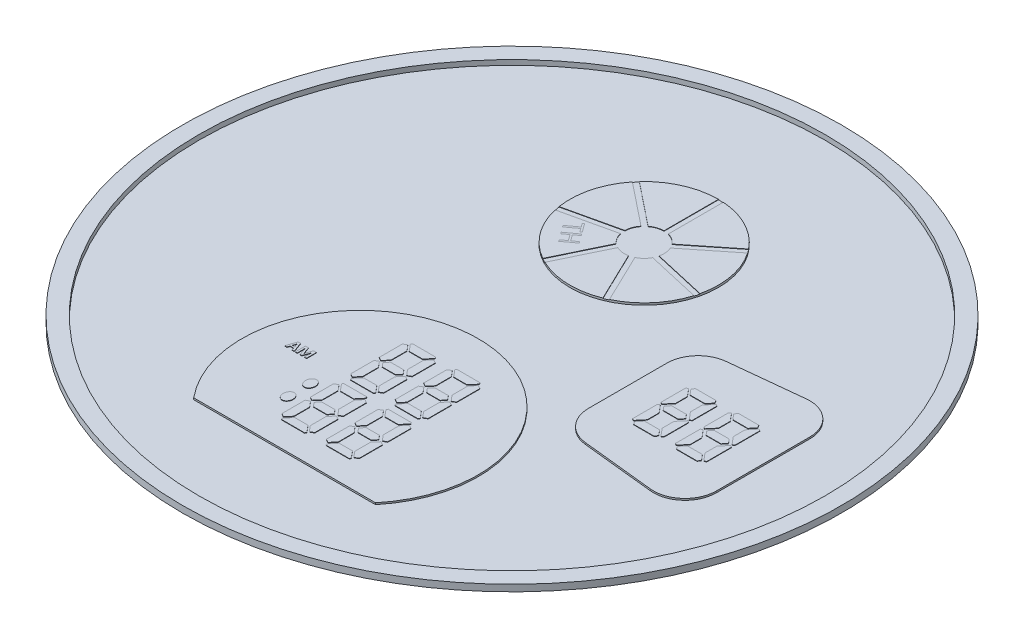
from build123d import *

# Parameters (mm, degrees)
SKETCH1_R           = 19.95
SKETCH1_R_2         = 3.942197232
BOSS_EXTRUDE1_DEPTH = 0.1
SKETCH2_R           = 4.5
BOSS_EXTRUDE2_DEPTH = 0.1
SKETCH2_5_RX        = 0.375
SKETCH2_5_RY        = 0.3
BOSS_EXTRUDE3_DEPTH = 0.125
SKETCH4_R           = 19.95
SKETCH4_R_2         = 18.95
BOSS_EXTRUDE4_DEPTH = 0.3


with BuildPart() as part:
    # Sketch1 → Boss-Extrude1 (new body)
    # profile 1 of 4: a face of its own
    with BuildSketch(Plane(origin=(0, 0, 0), x_dir=(1, 0, 0), z_dir=(0, 1, 0))):
        with Locations(Location((0, 0, 0), (0, 0, 270))):
            Circle(SKETCH1_R)
        with Locations((0, 8)):
            Circle(SKETCH1_R_2, mode=Mode.SUBTRACT)
        with BuildLine():
            ThreePointArc((8.4, -2.367660641), (8.528427587, -2.702225944), (8.847735768, -2.864921589))
            Line((8.847735768, -2.864921589), (13.247735768, -3.327380224))
            ThreePointArc((13.247735768, -3.327380224), (13.634565303, -3.201691689), (13.8, -2.830119276))
            Line((13.8, -2.830119276), (13.8, 2.830119276))
            ThreePointArc((13.8, 2.830119276), (13.634565303, 3.201691689), (13.247735768, 3.327380224))
            Line((13.247735768, 3.327380224), (8.847735768, 2.864921589))
            ThreePointArc((8.847735768, 2.864921589), (8.528427587, 2.702225944), (8.4, 2.367660641))
            Line((8.4, 2.367660641), (8.4, -2.367660641))
        make_face(mode=Mode.SUBTRACT)
        with BuildLine():
            ThreePointArc((4.8, -12.365833224), (0, -3.45), (-4.8, -12.365833224))
            Line((-4.8, -12.365833224), (4.8, -12.365833224))
        make_face(mode=Mode.SUBTRACT)
    # profile 2 of 4: a face of its own
    with BuildSketch(Plane(origin=(0, 0, 0), x_dir=(1, 0, 0), z_dir=(0, 1, 0))):
        with Locations((0, 8)):
            Circle(SKETCH1_R_2)
    # profile 3 of 4: a face of its own
    with BuildSketch(Plane(origin=(0, 0, 0), x_dir=(1, 0, 0), z_dir=(0, 1, 0))):
        with BuildLine():
            Line((-4.8, -12.365833224), (4.8, -12.365833224))
            ThreePointArc((4.8, -12.365833224), (0, -3.45), (-4.8, -12.365833224))
        make_face()
    # profile 4 of 4: a face of its own
    with BuildSketch(Plane(origin=(0, 0, 0), x_dir=(1, 0, 0), z_dir=(0, 1, 0))):
        with BuildLine():
            Line((8.4, 2.367660641), (8.4, -2.367660641))
            ThreePointArc((8.4, -2.367660641), (8.528427587, -2.702225944), (8.847735768, -2.864921589))
            Line((8.847735768, -2.864921589), (13.247735768, -3.327380224))
            ThreePointArc((13.247735768, -3.327380224), (13.634565303, -3.201691689), (13.8, -2.830119276))
            Line((13.8, -2.830119276), (13.8, 2.830119276))
            ThreePointArc((13.8, 2.830119276), (13.634565303, 3.201691689), (13.247735768, 3.327380224))
            Line((13.247735768, 3.327380224), (8.847735768, 2.864921589))
            ThreePointArc((8.847735768, 2.864921589), (8.528427587, 2.702225944), (8.4, 2.367660641))
        make_face()
    extrude(amount=BOSS_EXTRUDE1_DEPTH)

    # Sketch2 → Boss-Extrude2 (add)
    with BuildSketch(Plane(origin=(0, 0.1, 0), x_dir=(1, 0, 0), z_dir=(0, 1, 0))):
        with Locations(Location((0, 8, 0), (0, 0, 270))):
            Circle(SKETCH2_R)
        with BuildLine():
            Line((8.70139592, -4.257252242), (13.10139592, -4.719710877))
            ThreePointArc((13.10139592, -4.719710877), (14.571348152, -4.242094444), (15.2, -2.830119276))
            Line((15.2, -2.830119276), (15.2, 2.830119276))
            ThreePointArc((15.2, 2.830119276), (14.571348152, 4.242094444), (13.10139592, 4.719710877))
            Line((13.10139592, 4.719710877), (8.70139592, 4.257252242))
            ThreePointArc((8.70139592, 4.257252242), (7.488024832, 3.639008793), (7, 2.367660641))
            Line((7, 2.367660641), (7, -2.367660641))
            ThreePointArc((7, -2.367660641), (7.488024832, -3.639008793), (8.70139592, -4.257252242))
        make_face()
        with BuildLine():
            Line((-5.502332866, -13.765833224), (5.502332866, -13.765833224))
            ThreePointArc((5.502332866, -13.765833224), (0, -2.05), (-5.502332866, -13.765833224))
        make_face()
    extrude(amount=BOSS_EXTRUDE2_DEPTH)

    # Sketch2<5> → Boss-Extrude3 (add)
    # profile 1 of 53: a face of its own
    with BuildSketch(Plane(origin=(0, 0.1, 0), x_dir=(1, 0, 0), z_dir=(0, 1, 0))):
        Polygon((9.4, -0.492534305), (9.4, -1.205294923), (9.014327434, -1.664921589), (8.9, -1.598914614), (8.9, -0.098914614), (9.014327434, -0.032907639), align=None)
    # profile 2 of 53: a face of its own
    with BuildSketch(Plane(origin=(0, 0.1, 0), x_dir=(1, 0, 0), z_dir=(0, 1, 0))):
        Polygon((8.9, 1.613099336), (8.9, 0.113099336), (9.014327434, 0.047092361), (9.4, 0.506719027), (9.4, 1.219479645), (9.014327434, 1.679106311), align=None)
    # profile 3 of 53: a face of its own
    with BuildSketch(Plane(origin=(0, 0.1, 0), x_dir=(1, 0, 0), z_dir=(0, 1, 0))):
        Polygon((9.222384556, 1.879106311), (9.122384556, 1.70590123), (9.396598052, 1.379106311), (10.29817106, 1.379106311), (10.572384556, 1.70590123), (10.472384556, 1.879106311), align=None)
    # profile 4 of 53: a face of its own
    with BuildSketch(Plane(origin=(0, 0.1, 0), x_dir=(1, 0, 0), z_dir=(0, 1, 0))):
        Polygon((9.396598052, -0.242907639), (10.29817106, -0.242907639), (10.507945968, 0.007092361), (10.29817106, 0.257092361), (9.396598052, 0.257092361), (9.186823145, 0.007092361), align=None)
    # profile 5 of 53: a face of its own
    with BuildSketch(Plane(origin=(0, 0.1, 0), x_dir=(1, 0, 0), z_dir=(0, 1, 0))):
        Polygon((10.294769113, 0.506719027), (10.294769113, 1.219479645), (10.680441678, 1.679106311), (10.794769113, 1.613099336), (10.794769113, 0.113099336), (10.680441678, 0.047092361), align=None)
    # profile 6 of 53: a face of its own
    with BuildSketch(Plane(origin=(0, 0.1, 0), x_dir=(1, 0, 0), z_dir=(0, 1, 0))):
        Polygon((10.794769113, -1.598914614), (10.794769113, -0.098914614), (10.680441678, -0.032907639), (10.294769113, -0.492534305), (10.294769113, -1.205294923), (10.680441678, -1.664921589), align=None)
    # profile 7 of 53: a face of its own
    with BuildSketch(Plane(origin=(0, 0.1, 0), x_dir=(1, 0, 0), z_dir=(0, 1, 0))):
        Polygon((9.396598052, -1.364921589), (10.29817106, -1.364921589), (10.572384556, -1.691716508), (10.472384556, -1.864921589), (9.222384556, -1.864921589), (9.122384556, -1.691716508), align=None)
    # profile 8 of 53: a face of its own
    with BuildSketch(Plane(origin=(0, 0.1, 0), x_dir=(1, 0, 0), z_dir=(0, 1, 0))):
        Polygon((12.892940173, -1.364921589), (11.991367165, -1.364921589), (11.717153669, -1.691716508), (11.817153669, -1.864921589), (13.067153669, -1.864921589), (13.167153669, -1.691716508), align=None)
    # profile 9 of 53: a face of its own
    with BuildSketch(Plane(origin=(0, 0.1, 0), x_dir=(1, 0, 0), z_dir=(0, 1, 0))):
        Polygon((11.994769113, -0.492534305), (11.994769113, -1.205294923), (11.609096547, -1.664921589), (11.494769113, -1.598914614), (11.494769113, -0.098914614), (11.609096547, -0.032907639), align=None)
    # profile 10 of 53: a face of its own
    with BuildSketch(Plane(origin=(0, 0.1, 0), x_dir=(1, 0, 0), z_dir=(0, 1, 0))):
        Polygon((13.389538225, -1.598914614), (13.389538225, -0.098914614), (13.275210791, -0.032907639), (12.889538225, -0.492534305), (12.889538225, -1.205294923), (13.275210791, -1.664921589), align=None)
    # profile 11 of 53: a face of its own
    with BuildSketch(Plane(origin=(0, 0.1, 0), x_dir=(1, 0, 0), z_dir=(0, 1, 0))):
        Polygon((11.781592257, 0.007092361), (11.991367165, 0.257092361), (12.892940173, 0.257092361), (13.10271508, 0.007092361), (12.892940173, -0.242907639), (11.991367165, -0.242907639), align=None)
    # profile 12 of 53: a face of its own
    with BuildSketch(Plane(origin=(0, 0.1, 0), x_dir=(1, 0, 0), z_dir=(0, 1, 0))):
        Polygon((11.494769113, 1.613099336), (11.494769113, 0.113099336), (11.609096547, 0.047092361), (11.994769113, 0.506719027), (11.994769113, 1.219479645), (11.609096547, 1.679106311), align=None)
    # profile 13 of 53: a face of its own
    with BuildSketch(Plane(origin=(0, 0.1, 0), x_dir=(1, 0, 0), z_dir=(0, 1, 0))):
        Polygon((11.717153669, 1.70590123), (11.817153669, 1.879106311), (13.067153669, 1.879106311), (13.167153669, 1.70590123), (12.892940173, 1.379106311), (11.991367165, 1.379106311), align=None)
    # profile 14 of 53: a face of its own
    with BuildSketch(Plane(origin=(0, 0.1, 0), x_dir=(1, 0, 0), z_dir=(0, 1, 0))):
        Polygon((12.889538225, 0.506719027), (12.889538225, 1.219479645), (13.275210791, 1.679106311), (13.389538225, 1.613099336), (13.389538225, 0.113099336), (13.275210791, 0.047092361), align=None)
    # profile 15 of 53: a face of its own
    with BuildSketch(Plane(origin=(0, 0.1, 0), x_dir=(1, 0, 0), z_dir=(0, 1, 0))):
        Polygon((-1.4815235, -6.60137197), (-1.4815235, -7.555280001), (-1.770777925, -7.9), (-1.9815235, -7.778325985), (-1.9815235, -6.378325985), (-1.770777925, -6.25665197), align=None)
    # profile 16 of 53: a face of its own
    with BuildSketch(Plane(origin=(0, 0.1, 0), x_dir=(1, 0, 0), z_dir=(0, 1, 0))):
        Polygon((-1.388507306, -6.46665197), (-0.582270618, -6.46665197), (-0.37249571, -6.21665197), (-0.582270618, -5.96665197), (-1.388507306, -5.96665197), (-1.598282214, -6.21665197), align=None)
    # profile 17 of 53: a face of its own
    with BuildSketch(Plane(origin=(0, 0.1, 0), x_dir=(1, 0, 0), z_dir=(0, 1, 0))):
        Polygon((-1.9815235, -4.654977956), (-1.9815235, -6.054977956), (-1.770777925, -6.17665197), (-1.4815235, -5.831931971), (-1.4815235, -4.87802394), (-1.770777925, -4.533303941), align=None)
    # profile 18 of 53: a face of its own
    with BuildSketch(Plane(origin=(0, 0.1, 0), x_dir=(1, 0, 0), z_dir=(0, 1, 0))):
        Polygon((-0.489254424, -5.831931971), (-0.489254424, -4.87802394), (-0.2, -4.533303941), (0.010745576, -4.654977956), (0.010745576, -6.054977956), (-0.2, -6.17665197), align=None)
    # profile 19 of 53: a face of its own
    with BuildSketch(Plane(origin=(0, 0.1, 0), x_dir=(1, 0, 0), z_dir=(0, 1, 0))):
        Polygon((0.010745576, -7.778325985), (0.010745576, -6.378325985), (-0.2, -6.25665197), (-0.489254424, -6.60137197), (-0.489254424, -7.555280001), (-0.2, -7.9), align=None)
    # profile 20 of 53: a face of its own
    with BuildSketch(Plane(origin=(0, 0.1, 0), x_dir=(1, 0, 0), z_dir=(0, 1, 0))):
        Polygon((-1.388507306, -7.6), (-0.582270618, -7.6), (-0.235388962, -8.01339746), (-0.285388962, -8.1), (-1.685388962, -8.1), (-1.735388962, -8.01339746), align=None)
    # profile 21 of 53: a face of its own
    with BuildSketch(Plane(origin=(0, 0.1, 0), x_dir=(1, 0, 0), z_dir=(0, 1, 0))):
        Polygon((-1.388507306, -9), (-0.582270618, -9), (-0.235388962, -8.58660254), (-0.285388962, -8.5), (-1.685388962, -8.5), (-1.735388962, -8.58660254), align=None)
    # profile 22 of 53: a face of its own
    with BuildSketch(Plane(origin=(0, 0.1, 0), x_dir=(1, 0, 0), z_dir=(0, 1, 0))):
        Polygon((-1.9815235, -8.821674015), (-1.9815235, -10.221674015), (-1.770777925, -10.34334803), (-1.4815235, -9.99862803), (-1.4815235, -9.044719999), (-1.770777925, -8.7), align=None)
    # profile 23 of 53: a face of its own
    with BuildSketch(Plane(origin=(0, 0.1, 0), x_dir=(1, 0, 0), z_dir=(0, 1, 0))):
        Polygon((-1.4815235, -10.768068029), (-1.4815235, -11.72197606), (-1.770777925, -12.066696059), (-1.9815235, -11.945022044), (-1.9815235, -10.545022044), (-1.770777925, -10.42334803), align=None)
    # profile 24 of 53: a face of its own
    with BuildSketch(Plane(origin=(0, 0.1, 0), x_dir=(1, 0, 0), z_dir=(0, 1, 0))):
        Polygon((-0.37249571, -10.38334803), (-0.582270618, -10.63334803), (-1.388507306, -10.63334803), (-1.598282214, -10.38334803), (-1.388507306, -10.13334803), (-0.582270618, -10.13334803), align=None)
    # profile 25 of 53: a face of its own
    with BuildSketch(Plane(origin=(0, 0.1, 0), x_dir=(1, 0, 0), z_dir=(0, 1, 0))):
        Polygon((-0.489254424, -9.99862803), (-0.489254424, -9.044719999), (-0.2, -8.7), (0.010745576, -8.821674015), (0.010745576, -10.221674015), (-0.2, -10.34334803), align=None)
    # profile 26 of 53: a face of its own
    with BuildSketch(Plane(origin=(0, 0.1, 0), x_dir=(1, 0, 0), z_dir=(0, 1, 0))):
        Polygon((0.010745576, -11.945022044), (0.010745576, -10.545022044), (-0.2, -10.42334803), (-0.489254424, -10.768068029), (-0.489254424, -11.72197606), (-0.2, -12.066696059), align=None)
    # profile 27 of 53: a face of its own
    with BuildSketch(Plane(origin=(0, 0.1, 0), x_dir=(1, 0, 0), z_dir=(0, 1, 0))):
        Polygon((-0.235388962, -12.180093519), (-0.285388962, -12.266696059), (-1.685388962, -12.266696059), (-1.735388962, -12.180093519), (-1.388507306, -11.766696059), (-0.582270618, -11.766696059), align=None)
    # profile 28 of 53: a face of its own
    with BuildSketch(Plane(origin=(0, 0.1, 0), x_dir=(1, 0, 0), z_dir=(0, 1, 0))):
        Polygon((2.406880114, -12.266696059), (2.456880114, -12.180093519), (2.109998458, -11.766696059), (1.30376177, -11.766696059), (0.956880114, -12.180093519), (1.006880114, -12.266696059), align=None)
    # profile 29 of 53: a face of its own
    with BuildSketch(Plane(origin=(0, 0.1, 0), x_dir=(1, 0, 0), z_dir=(0, 1, 0))):
        Polygon((1.210745576, -10.768068029), (1.210745576, -11.72197606), (0.921491151, -12.066696059), (0.710745576, -11.945022044), (0.710745576, -10.545022044), (0.921491151, -10.42334803), align=None)
    # profile 30 of 53: a face of its own
    with BuildSketch(Plane(origin=(0, 0.1, 0), x_dir=(1, 0, 0), z_dir=(0, 1, 0))):
        Polygon((2.109998458, -10.13334803), (1.30376177, -10.13334803), (1.093986862, -10.38334803), (1.30376177, -10.63334803), (2.109998458, -10.63334803), (2.319773366, -10.38334803), align=None)
    # profile 31 of 53: a face of its own
    with BuildSketch(Plane(origin=(0, 0.1, 0), x_dir=(1, 0, 0), z_dir=(0, 1, 0))):
        Polygon((2.703014652, -11.945022044), (2.703014652, -10.545022044), (2.492269076, -10.42334803), (2.203014652, -10.768068029), (2.203014652, -11.72197606), (2.492269076, -12.066696059), align=None)
    # profile 32 of 53: a face of its own
    with BuildSketch(Plane(origin=(0, 0.1, 0), x_dir=(1, 0, 0), z_dir=(0, 1, 0))):
        Polygon((2.203014652, -9.99862803), (2.203014652, -9.044719999), (2.492269076, -8.7), (2.703014652, -8.821674015), (2.703014652, -10.221674015), (2.492269076, -10.34334803), align=None)
    # profile 33 of 53: a face of its own
    with BuildSketch(Plane(origin=(0, 0.1, 0), x_dir=(1, 0, 0), z_dir=(0, 1, 0))):
        Polygon((0.710745576, -8.821674015), (0.710745576, -10.221674015), (0.921491151, -10.34334803), (1.210745576, -9.99862803), (1.210745576, -9.044719999), (0.921491151, -8.7), align=None)
    # profile 34 of 53: a face of its own
    with BuildSketch(Plane(origin=(0, 0.1, 0), x_dir=(1, 0, 0), z_dir=(0, 1, 0))):
        Polygon((2.109998458, -9), (1.30376177, -9), (0.956880114, -8.58660254), (1.006880114, -8.5), (2.406880114, -8.5), (2.456880114, -8.58660254), align=None)
    # profile 35 of 53: a face of its own
    with BuildSketch(Plane(origin=(0, 0.1, 0), x_dir=(1, 0, 0), z_dir=(0, 1, 0))):
        Polygon((2.109998458, -7.6), (1.30376177, -7.6), (0.956880114, -8.01339746), (1.006880114, -8.1), (2.406880114, -8.1), (2.456880114, -8.01339746), align=None)
    # profile 36 of 53: a face of its own
    with BuildSketch(Plane(origin=(0, 0.1, 0), x_dir=(1, 0, 0), z_dir=(0, 1, 0))):
        Polygon((2.703014652, -7.778325985), (2.703014652, -6.378325985), (2.492269076, -6.25665197), (2.203014652, -6.60137197), (2.203014652, -7.555280001), (2.492269076, -7.9), align=None)
    # profile 37 of 53: a face of its own
    with BuildSketch(Plane(origin=(0, 0.1, 0), x_dir=(1, 0, 0), z_dir=(0, 1, 0))):
        Polygon((1.210745576, -6.60137197), (1.210745576, -7.555280001), (0.921491151, -7.9), (0.710745576, -7.778325985), (0.710745576, -6.378325985), (0.921491151, -6.25665197), align=None)
    # profile 38 of 53: a face of its own
    with BuildSketch(Plane(origin=(0, 0.1, 0), x_dir=(1, 0, 0), z_dir=(0, 1, 0))):
        Polygon((1.093986862, -6.21665197), (1.30376177, -5.96665197), (2.109998458, -5.96665197), (2.319773366, -6.21665197), (2.109998458, -6.46665197), (1.30376177, -6.46665197), align=None)
    # profile 39 of 53: a face of its own
    with BuildSketch(Plane(origin=(0, 0.1, 0), x_dir=(1, 0, 0), z_dir=(0, 1, 0))):
        Polygon((2.203014652, -5.831931971), (2.203014652, -4.87802394), (2.492269076, -4.533303941), (2.703014652, -4.654977956), (2.703014652, -6.054977956), (2.492269076, -6.17665197), align=None)
    # profile 40 of 53: a face of its own
    with BuildSketch(Plane(origin=(0, 0.1, 0), x_dir=(1, 0, 0), z_dir=(0, 1, 0))):
        Polygon((0.710745576, -4.654977956), (0.710745576, -6.054977956), (0.921491151, -6.17665197), (1.210745576, -5.831931971), (1.210745576, -4.87802394), (0.921491151, -4.533303941), align=None)
    # profile 41 of 53: a face of its own
    with BuildSketch(Plane(origin=(0, 0.1, 0), x_dir=(1, 0, 0), z_dir=(0, 1, 0))):
        Polygon((0.956880114, -4.419906481), (1.006880114, -4.333303941), (2.406880114, -4.333303941), (2.456880114, -4.419906481), (2.109998458, -4.833303941), (1.30376177, -4.833303941), align=None)
    # profile 42 of 53: a face of its own
    with BuildSketch(Plane(origin=(0, 0.1, 0), x_dir=(1, 0, 0), z_dir=(0, 1, 0))):
        with Locations(Location((-2.7, -9.5), (0, 0, -90))):
            Ellipse(SKETCH2_5_RX, SKETCH2_5_RY)
    # profile 43 of 53: a face of its own
    with BuildSketch(Plane(origin=(0, 0.1, 0), x_dir=(1, 0, 0), z_dir=(0, 1, 0))):
        with Locations(Location((-2.7, -10.85), (0, 0, 90))):
            Ellipse(SKETCH2_5_RX, SKETCH2_5_RY)
    # profile 44 of 53: a face of its own
    with BuildSketch(Plane(origin=(0, 0.1, 0), x_dir=(1, 0, 0), z_dir=(0, 1, 0))):
        Polygon((-5.096247513, -7.7), (-4.876735318, -8.3), (-5.014273428, -8.3), (-5.058518855, -8.16097561), (-5.274486842, -8.16097561), (-5.318046294, -8.3), (-5.454784099, -8.3), (-5.242588977, -7.7), align=None)
        with BuildLine():
            add(Edge.make_bspline(
                [(-5.169418245, -7.802439024), (-5.171559542, -7.828691485), (-5.17959355, -7.853772866)],
                knots=[0, 0, 0, 1, 1, 1], degree=2))
            Line((-5.17959355, -7.853772866), (-5.24670483, -8.065853659))
            Line((-5.24670483, -8.065853659), (-5.088701781, -8.065853659))
            Line((-5.088701781, -8.065853659), (-5.160157574, -7.855373476))
            add(Edge.make_bspline(
                [(-5.160157574, -7.855373476), (-5.1624519, -7.847751669), (-5.166739754, -7.830280487), (-5.168504652, -7.812371867), (-5.169418245, -7.802439024)],
                knots=[0, 0, 0, 0, 0.443614801, 1, 1, 1, 1], degree=3))
        make_face(mode=Mode.SUBTRACT)
    # profile 45 of 53: a face of its own
    with BuildSketch(Plane(origin=(0, 0.1, 0), x_dir=(1, 0, 0), z_dir=(0, 1, 0))):
        with BuildLine():
            add(Edge.make_bspline(
                [(-4.467893855, -8.147141768), (-4.464167497, -8.131729531), (-4.45649613, -8.103116227), (-4.447796736, -8.074792444), (-4.443084403, -8.061852134)],
                knots=[0, 0, 0, 0, 0.535259352, 1, 1, 1, 1], degree=3))
            Line((-4.443084403, -8.061852134), (-4.313320684, -7.7))
            Line((-4.313320684, -7.7), (-4.137710928, -7.7))
            Line((-4.137710928, -7.7), (-4.137710928, -8.3))
            Line((-4.137710928, -8.3), (-4.262101172, -8.3))
            Line((-4.262101172, -8.3), (-4.262101172, -7.936318598))
            add(Edge.make_bspline(
                [(-4.262101172, -7.936318598), (-4.262245425, -7.927392234), (-4.261638117, -7.913595575), (-4.260654613, -7.894655063), (-4.259500798, -7.879217865), (-4.257963147, -7.862990445), (-4.255724877, -7.839702452), (-4.253207015, -7.821913148), (-4.251697208, -7.809756098)],
                knots=[0, 0, 0, 0, 0.210620797, 0.325950847, 0.447739282, 0.576026913, 0.710755565, 1, 1, 1, 1], degree=3))
            Line((-4.251697208, -7.809756098), (-4.254784099, -7.809756098))
            add(Edge.make_bspline(
                [(-4.254784099, -7.809756098), (-4.25650106, -7.818591594), (-4.259323241, -7.831180712), (-4.262771934, -7.847200648), (-4.265192693, -7.857410635), (-4.267454704, -7.866450893), (-4.270146724, -7.876111225), (-4.272060325, -7.882767103), (-4.273534099, -7.886699695)],
                knots=[0, 0, 0, 0, 0.340692301, 0.488415946, 0.620345347, 0.737917169, 0.841171029, 1, 1, 1, 1], degree=3))
            Line((-4.273534099, -7.886699695), (-4.423076781, -8.3))
            Line((-4.423076781, -8.3), (-4.525515806, -8.3))
            Line((-4.525515806, -8.3), (-4.67494416, -7.89058689))
            add(Edge.make_bspline(
                [(-4.67494416, -7.89058689), (-4.676195274, -7.887138758), (-4.677936287, -7.881079429), (-4.680227219, -7.87184304), (-4.68254393, -7.862568351), (-4.684891974, -7.8516006), (-4.688763894, -7.833854729), (-4.691945012, -7.819751747), (-4.693808489, -7.809756098)],
                knots=[0, 0, 0, 0, 0.132433005, 0.227599311, 0.343803583, 0.477753789, 0.632760768, 1, 1, 1, 1], degree=3))
            Line((-4.693808489, -7.809756098), (-4.697238367, -7.809756098))
            add(Edge.make_bspline(
                [(-4.697238367, -7.809756098), (-4.693692508, -7.88534338), (-4.693808489, -7.96101372)],
                knots=[0, 0, 0, 1, 1, 1], degree=2))
            Line((-4.693808489, -7.96101372), (-4.693808489, -8.3))
            Line((-4.693808489, -8.3), (-4.81088166, -8.3))
            Line((-4.81088166, -8.3), (-4.81088166, -7.7))
            Line((-4.81088166, -7.7), (-4.620637757, -7.7))
            Line((-4.620637757, -7.7), (-4.492474647, -8.062652439))
            add(Edge.make_bspline(
                [(-4.492474647, -8.062652439), (-4.487422437, -8.076996385), (-4.478379105, -8.104752239), (-4.472599161, -8.133369516), (-4.470523428, -8.147141768)],
                knots=[0, 0, 0, 0, 0.522065055, 1, 1, 1, 1], degree=3))
            Line((-4.470523428, -8.147141768), (-4.467893855, -8.147141768))
        make_face()
    # profile 46 of 53: a face of its own
    with BuildSketch(Plane(origin=(0, 0.1, 0), x_dir=(1, 0, 0), z_dir=(0, 1, 0))):
        with BuildLine():
            Line((-0.938197779, 8.748187762), (-3.518241671, 10.805704108))
            ThreePointArc((-3.518241671, 10.805704108), (-4.351338172, 9.147107715), (-4.444171749, 7.293361858))
            Line((-4.444171749, 7.293361858), (-1.19952015, 8.033932412))
            ThreePointArc((-1.19952015, 8.033932412), (-1.126942617, 8.412310972), (-0.938197779, 8.748187762))
        make_face()
    # profile 47 of 53: a face of its own
    with BuildSketch(Plane(origin=(0, 0.1, 0), x_dir=(1, 0, 0), z_dir=(0, 1, 0))):
        with BuildLine():
            Line((-1.169913495, 7.732974879), (-4.387175605, 6.998655797))
            ThreePointArc((-4.387175605, 6.998655797), (-3.6098599, 5.313196788), (-2.218423817, 4.084824938))
            Line((-2.218423817, 4.084824938), (-0.774418009, 7.083333895))
            ThreePointArc((-0.774418009, 7.083333895), (-1.024994927, 7.375992469), (-1.169913495, 7.732974879))
        make_face()
    # profile 48 of 53: a face of its own
    with BuildSketch(Plane(origin=(0, 0.1, 0), x_dir=(1, 0, 0), z_dir=(0, 1, 0))):
        with BuildLine():
            ThreePointArc((-1.952476826, 3.945640094), (-0.150083496, 3.50250348), (1.677842497, 3.824494694))
            Line((1.677842497, 3.824494694), (0.233836688, 6.823003652))
            ThreePointArc((0.233836688, 6.823003652), (-0.151205151, 6.809564364), (-0.520660487, 6.918837359))
            Line((-0.520660487, 6.918837359), (-1.952476826, 3.945640094))
        make_face()
    # profile 49 of 53: a face of its own
    with BuildSketch(Plane(origin=(0, 0.1, 0), x_dir=(1, 0, 0), z_dir=(0, 1, 0))):
        with BuildLine():
            ThreePointArc((1.952476826, 3.945640094), (3.422708842, 5.078516784), (4.310659189, 6.708405111))
            Line((4.310659189, 6.708405111), (1.06600759, 7.448975665))
            ThreePointArc((1.06600759, 7.448975665), (0.836445188, 7.139558574), (0.520660487, 6.918837359))
            Line((0.520660487, 6.918837359), (1.952476826, 3.945640094))
        make_face()
    # profile 50 of 53: a face of its own
    with BuildSketch(Plane(origin=(0, 0.1, 0), x_dir=(1, 0, 0), z_dir=(0, 1, 0))):
        with BuildLine():
            ThreePointArc((4.5, 8), (4.294681429, 9.343767622), (3.69746159, 10.564912823))
            Line((3.69746159, 10.564912823), (1.095453034, 8.489880241))
            ThreePointArc((1.095453034, 8.489880241), (1.19423524, 8.117482727), (1.169913495, 7.732974879))
            Line((1.169913495, 7.732974879), (4.387175605, 6.998655797))
            ThreePointArc((4.387175605, 6.998655797), (4.471704945, 7.496159858), (4.5, 8))
        make_face()
    # profile 51 of 53: a face of its own
    with BuildSketch(Plane(origin=(0, 0.1, 0), x_dir=(1, 0, 0), z_dir=(0, 1, 0))):
        with BuildLine():
            Line((0.3, 12.489988864), (0.3, 9.161895004))
            ThreePointArc((0.3, 9.161895004), (0.652741798, 9.006939991), (0.938197779, 8.748187762))
            Line((0.938197779, 8.748187762), (3.518241671, 10.805704108))
            ThreePointArc((3.518241671, 10.805704108), (2.086611164, 11.986985559), (0.3, 12.489988864))
        make_face()
    # profile 52 of 53: a face of its own
    with BuildSketch(Plane(origin=(0, 0.1, 0), x_dir=(1, 0, 0), z_dir=(0, 1, 0))):
        with BuildLine():
            Line((0, 9.2), (0, 12.5))
            ThreePointArc((0, 12.5), (-1.816170049, 12.117223136), (-3.323367709, 11.034011712))
            Line((-3.323367709, 11.034011712), (-0.721359153, 8.95897913))
            ThreePointArc((-0.721359153, 8.95897913), (-0.380279531, 9.138150903), (0, 9.2))
        make_face()
    # profile 53 of 53: a face of its own
    with BuildSketch(Plane(origin=(0, 0.1, 0), x_dir=(1, 0, 0), z_dir=(0, 1, 0))):
        Polygon((-1.685388962, -4.333303941), (-1.735388962, -4.419906481), (-1.388507306, -4.833303941), (-0.582270618, -4.833303941), (-0.235388962, -4.419906481), (-0.285388962, -4.333303941), align=None)
    extrude(amount=BOSS_EXTRUDE3_DEPTH)

    # Sketch4 → Boss-Extrude4 (add)
    with BuildSketch(Plane(origin=(0, 0.1, 0), x_dir=(1, 0, 0), z_dir=(0, 1, 0))):
        with Locations(Location((0, 0, 0), (0, 0, 270))):
            Circle(SKETCH4_R)
        with Locations(Location((0, 0, 0), (0, 0, 270))):
            Circle(SKETCH4_R_2, mode=Mode.SUBTRACT)
    extrude(amount=BOSS_EXTRUDE4_DEPTH)


solid = part.part
